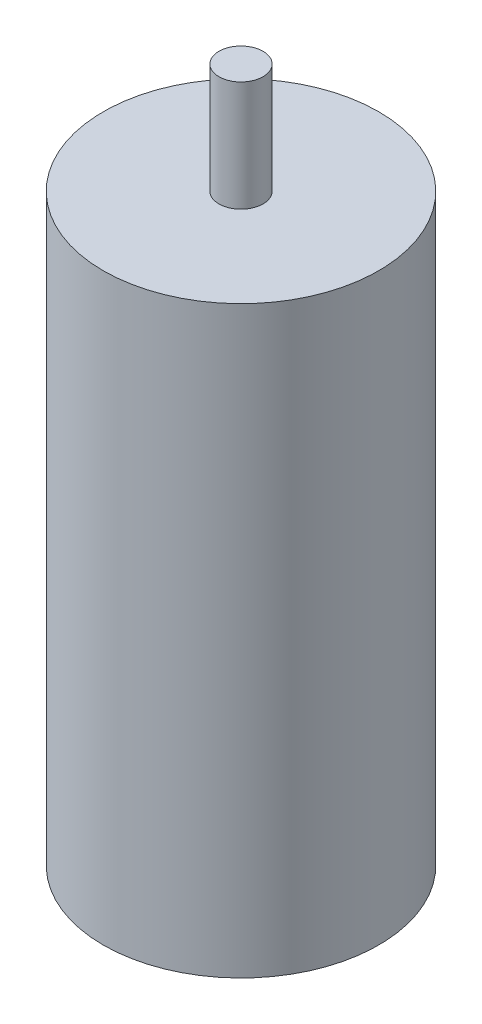
from build123d import *

# Parameters (mm, degrees)
SKETCH1_R           = 12.5
BOSS_EXTRUDE1_DEPTH = 53
SKETCH2_R           = 2
BOSS_EXTRUDE2_DEPTH = 10


with BuildPart() as part:
    # Sketch1 → Boss-Extrude1 (new body)
    with BuildSketch(Plane(origin=(0, 0, 0), x_dir=(1, 0, 0), z_dir=(0, 1, 0))):
        with Locations(Location((0, 0, 0), (0, 0, 270))):
            Circle(SKETCH1_R)
    extrude(amount=BOSS_EXTRUDE1_DEPTH)

    # Sketch2 → Boss-Extrude2 (add)
    with BuildSketch(Plane(origin=(0, 53, 0), x_dir=(1, 0, 0), z_dir=(0, 1, 0))):
        with Locations(Location((0, 0, 0), (0, 0, 270))):
            Circle(SKETCH2_R)
    extrude(amount=BOSS_EXTRUDE2_DEPTH)


solid = part.part
